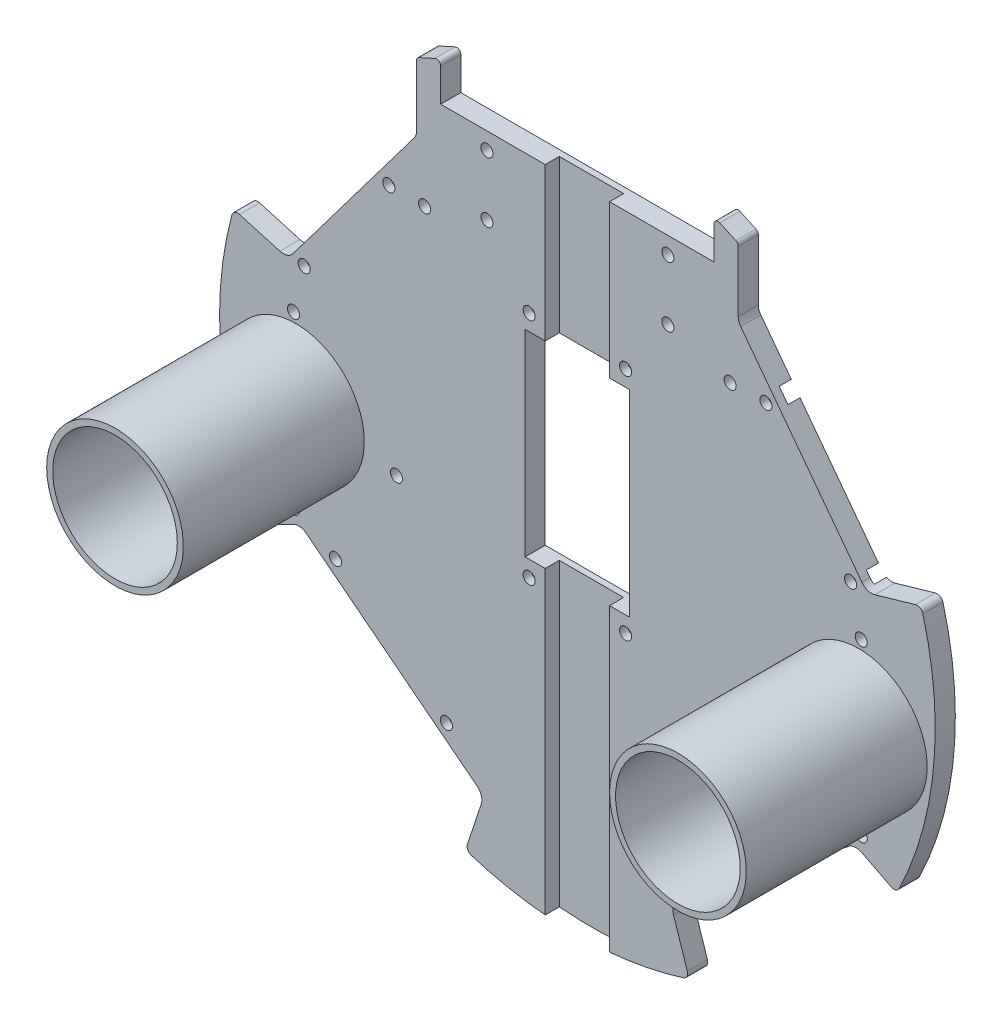
from build123d import *

# Parameters (mm, degrees)
EXTRUDE_2007_DEPTH      = 5
FILLET_3_R              = 1.5
FILLET_4_R              = 1.5
FILLET_5_R              = 1.5
FILLET_6_R              = 1.5
FILLET_8_R              = 1.5
FILLET_9_R              = 1.5
FILLET_10_R             = 1
SKETCH_3_R              = 17
EXTRUDE_3379_DEPTH      = 45
SKETCH_4_R              = 15.5
CUT_EXTRUDE_3486_DEPTH  = 45
SKETCH_5_R              = 1.5
CUT_EXTRUDE_4485_DEPTH  = 2
SKETCH_12_R             = 3.5
CUT_EXTRUDE_5429_DEPTH  = 3
CUT_EXTRUDE_START       = -3.5
CUT_EXTRUDE_6212_DEPTH  = 3.5
SKETCH_8_W              = 26
SKETCH_8_H              = 49
CUT_EXTRUDE_6714_DEPTH  = 5
SKETCH_9_R              = 1.5
CUT_EXTRUDE_7323_DEPTH  = 2
SKETCH_10_R             = 3.5
CUT_EXTRUDE_8111_DEPTH  = 3
SKETCH_11_R             = 1.5
CUT_EXTRUDE_8692_DEPTH  = 5
SKETCH_14_W             = 68
SKETCH_14_H             = 4
CUT_EXTRUDE_1_DEPTH     = 10
SKETCH_15_R             = 1.5
CUT_EXTRUDE_9738_DEPTH  = 134.667497919
SKETCH_16_R             = 1.5
CUT_EXTRUDE_10559_DEPTH = 10


with BuildPart() as part:
    # 草图1 → Extrude 2007 (new body)
    with BuildSketch(Plane.XY):
        with BuildLine():
            Line((40.60409347, 62.431357903), (55.904485703, 42.127051621))
            Line((55.904485703, 42.127051621), (70.756031924, 22.418384115))
            ThreePointArc((70.756031924, 22.418384115), (72.202279258, 21.378104776), (73.983419946, 21.341358278))
            Line((73.983419946, 21.341358278), (85.513303574, 24.667284243))
            ThreePointArc((85.513303574, 24.667284243), (88.605814226, -8.36717906), (79.384125876, -40.238794203))
            Line((79.384125876, -40.238794203), (70.659905832, -35.816599072))
            ThreePointArc((70.659905832, -35.816599072), (69.012874234, -35.506582977), (67.456557556, -36.128436223))
            Line((67.456557556, -36.128436223), (43.096303273, -55.160752752))
            Line((43.096303273, -55.160752752), (24.916466517, -69.364397902))
            ThreePointArc((24.916466517, -69.364397902), (23.892889166, -70.856722021), (23.91379502, -72.666226046))
            Line((23.91379502, -72.666226046), (27.821277866, -84.539792393))
            ThreePointArc((27.821277866, -84.539792393), (0, -89), (-27.821277866, -84.539792393))
            Line((-27.821277866, -84.539792393), (-23.91379502, -72.666226046))
            ThreePointArc((-23.91379502, -72.666226046), (-23.892889166, -70.856722021), (-24.916466517, -69.364397902))
            Line((-24.916466517, -69.364397902), (-43.096303273, -55.160752752))
            Line((-43.096303273, -55.160752752), (-67.456557556, -36.128436223))
            ThreePointArc((-67.456557556, -36.128436223), (-69.012874234, -35.506582977), (-70.659905832, -35.816599072))
            Line((-70.659905832, -35.816599072), (-79.384125876, -40.238794203))
            ThreePointArc((-79.384125876, -40.238794203), (-88.605814226, -8.36717906), (-85.513303574, 24.667284243))
            Line((-85.513303574, 24.667284243), (-73.983419946, 21.341358278))
            ThreePointArc((-73.983419946, 21.341358278), (-72.202279258, 21.378104776), (-70.756031924, 22.418384115))
            Line((-70.756031924, 22.418384115), (-55.904485703, 42.127051621))
            Line((-55.904485703, 42.127051621), (-40.60409347, 62.431357903))
            ThreePointArc((-40.60409347, 62.431357903), (-40.155029034, 63.284889003), (-40, 64.236802972))
            Line((-40, 64.236802972), (-40, 74))
            Line((-40, 74), (-40, 80.06403687))
            Line((-40, 80.06403687), (-34, 82.790397994))
            Line((-34, 82.790397994), (-34, 77))
            Line((-34, 77), (34, 77))
            Line((34, 77), (34, 82.790397994))
            Line((34, 82.790397994), (40, 80.06403687))
            Line((40, 80.06403687), (40, 74))
            Line((40, 74), (40, 64.236802972))
            ThreePointArc((40, 64.236802972), (40.155029034, 63.284889003), (40.60409347, 62.431357903))
        make_face()
    extrude(amount=EXTRUDE_2007_DEPTH)

    # 圆角3
    fillet_3_edges = [part.edges().sort_by_distance(p)[0] for p in [
        (79.384125876, -40.238794203, 2.5),
    ]]
    fillet(fillet_3_edges, radius=FILLET_3_R)

    # 圆角4
    fillet_4_edges = [part.edges().sort_by_distance(p)[0] for p in [
        (27.821277866, -84.539792393, 2.5),
    ]]
    fillet(fillet_4_edges, radius=FILLET_4_R)

    # 圆角5
    fillet_5_edges = [part.edges().sort_by_distance(p)[0] for p in [
        (-27.821277866, -84.539792393, 2.5),
    ]]
    fillet(fillet_5_edges, radius=FILLET_5_R)

    # 圆角6
    fillet_6_edges = [part.edges().sort_by_distance(p)[0] for p in [
        (-79.384125876, -40.238794203, 2.5),
    ]]
    fillet(fillet_6_edges, radius=FILLET_6_R)

    # 圆角8
    fillet_8_edges = [part.edges().sort_by_distance(p)[0] for p in [
        (85.513303574, 24.667284243, 2.5),
    ]]
    fillet(fillet_8_edges, radius=FILLET_8_R)

    # 圆角9
    fillet_9_edges = [part.edges().sort_by_distance(p)[0] for p in [
        (-85.513303574, 24.667284243, 2.5),
    ]]
    fillet(fillet_9_edges, radius=FILLET_9_R)

    # 圆角10
    fillet_10_edges = [part.edges().sort_by_distance(p)[0] for p in [
        (-40, 80.06403687, 2.5),
        (-34, 82.790397994, 2.5),
        (34, 82.790397994, 2.5),
        (40, 80.06403687, 2.5),
    ]]
    fillet(fillet_10_edges, radius=FILLET_10_R)

    # 草图3 → Extrude 3379 (add)
    with BuildSketch(Plane.XY.offset(5)):
        with Locations(Location((70, -9.25, 0), (0, 0, 180))):
            Circle(SKETCH_3_R)
    extrude_3379 = extrude(amount=EXTRUDE_3379_DEPTH)

    # 草图4 → Cut-Extrude 3486 (cut)
    with BuildSketch(Plane.XY.offset(50)):
        with Locations((70, -9.25)):
            Circle(SKETCH_4_R)
    cut_extrude_3486 = extrude(amount=-CUT_EXTRUDE_3486_DEPTH, mode=Mode.SUBTRACT)

    # 镜向1: Extrude 3379 across plane
    add(extrude_3379.mirror(Plane(origin=(0, 0, 0), x_dir=(0, 0, 1), z_dir=(1, 0, 0))))

    # 镜向2: Cut-Extrude 3486 across plane
    add(cut_extrude_3486.mirror(Plane(origin=(0, 0, 0), x_dir=(0, 0, 1), z_dir=(1, 0, 0))), mode=Mode.SUBTRACT)

    # 草图5 → Cut-Extrude 4485 (cut)
    with BuildSketch(Plane.XY.offset(5)):
        with Locations((46.888613918, 49.106597162)):
            Circle(SKETCH_5_R)
        with Locations((67.952139729, 21.15435431)):
            Circle(SKETCH_5_R)
        with Locations(Location((-67.952139729, 21.15435431, 0), (0, 0, 180))):
            Circle(SKETCH_5_R)
        with Locations(Location((-46.888613918, 49.106597162, 0), (0, 0, 180))):
            Circle(SKETCH_5_R)
        with Locations((60.161576933, -38.020845084)):
            Circle(SKETCH_5_R)
        with Locations((32.581200557, -59.56899672)):
            Circle(SKETCH_5_R)
        with Locations(Location((-60.161576933, -38.020845084, 0), (0, 0, 180))):
            Circle(SKETCH_5_R)
        with Locations(Location((-32.581200557, -59.56899672, 0), (0, 0, 180))):
            Circle(SKETCH_5_R)
    extrude(amount=-CUT_EXTRUDE_4485_DEPTH, mode=Mode.SUBTRACT)

    # 草图12 → Cut-Extrude 5429 (cut)
    with BuildSketch(Plane(origin=(0, 0, 0), x_dir=(-1, 0, 0), z_dir=(0, 0, -1))):
        with Locations((46.888613918, 49.106597162)):
            Circle(SKETCH_12_R)
        with Locations((68.553954752, 20.3557188)):
            Circle(SKETCH_12_R)
        with Locations((-68.553954752, 20.3557188)):
            Circle(SKETCH_12_R)
        with Locations((-46.888613918, 49.106597162)):
            Circle(SKETCH_12_R)
        with Locations((32.581200557, -59.56899672)):
            Circle(SKETCH_12_R)
        with Locations((60.161576933, -38.020845084)):
            Circle(SKETCH_12_R)
        with Locations((13.527038551, -115.928745256)):
            Circle(SKETCH_12_R)
        with Locations((-60.161576933, -38.020845084)):
            Circle(SKETCH_12_R)
        with Locations((-32.581200557, -59.56899672)):
            Circle(SKETCH_12_R)
    extrude(amount=-CUT_EXTRUDE_5429_DEPTH, mode=Mode.SUBTRACT)

    # 草图7 → Cut-Extrude 6212 (cut)
    with BuildSketch(Plane.XY.offset(5).offset(CUT_EXTRUDE_START)):
        with BuildLine():
            Line((-8, 77), (-8, -88.639720216))
            ThreePointArc((-8, -88.639720216), (0, -89), (8, -88.639720216))
            Line((8, -88.639720216), (8, 77))
            Line((8, 77), (-8, 77))
        make_face()
    extrude(amount=CUT_EXTRUDE_6212_DEPTH, mode=Mode.SUBTRACT)

    # 草图8 → Cut-Extrude 6714 (cut)
    with BuildSketch(Plane.XY.offset(5)):
        with Locations((0, 10.5)):
            Rectangle(SKETCH_8_W, SKETCH_8_H)
    extrude(amount=-CUT_EXTRUDE_6714_DEPTH, mode=Mode.SUBTRACT)

    # 草图9 → Cut-Extrude 7323 (cut)
    with BuildSketch(Plane.XY.offset(5)):
        with Locations((12, 39)):
            Circle(SKETCH_9_R)
        with Locations(Location((-12, 39, 0), (0, 0, 180))):
            Circle(SKETCH_9_R)
        with Locations((-12, -18)):
            Circle(SKETCH_9_R)
        with Locations(Location((12, -18, 0), (0, 0, 180))):
            Circle(SKETCH_9_R)
    extrude(amount=-CUT_EXTRUDE_7323_DEPTH, mode=Mode.SUBTRACT)

    # 草图10 → Cut-Extrude 8111 (cut)
    with BuildSketch(Plane(origin=(0, 0, 0), x_dir=(-1, 0, 0), z_dir=(0, 0, -1))):
        with Locations((12, 39)):
            Circle(SKETCH_10_R)
        with Locations(Location((-12, 39, 0), (0, 0, 180))):
            Circle(SKETCH_10_R)
        with Locations(Location((12, -18, 0), (0, 0, 180))):
            Circle(SKETCH_10_R)
        with Locations((-12, -18)):
            Circle(SKETCH_10_R)
    extrude(amount=-CUT_EXTRUDE_8111_DEPTH, mode=Mode.SUBTRACT)

    # 草图11 → Cut-Extrude 8692 (cut)
    with BuildSketch(Plane.XY.offset(5)):
        with Locations((22.5, 68.8)):
            Circle(SKETCH_11_R)
        with Locations((22.5, 53.8)):
            Circle(SKETCH_11_R)
        with Locations(Location((-22.5, 53.8, 0), (0, 0, 180))):
            Circle(SKETCH_11_R)
        with Locations(Location((-22.5, 68.8, 0), (0, 0, 180))):
            Circle(SKETCH_11_R)
    extrude(amount=-CUT_EXTRUDE_8692_DEPTH, mode=Mode.SUBTRACT)

    # 草图14 → 切除-拉伸1 (cut)
    with BuildSketch(Plane(origin=(0, 0, 0), x_dir=(-1, 0, 0), z_dir=(0, 0, -1))):
        with Locations((0, 75)):
            Rectangle(SKETCH_14_W, SKETCH_14_H)
    extrude(amount=-CUT_EXTRUDE_1_DEPTH, mode=Mode.SUBTRACT)

    # 草图15 → Cut-Extrude 9738 (cut, through all)
    with BuildSketch(Plane.XY.offset(5)):
        with Locations(Location((-45, -12.5, 0), (0, 0, 180))):
            Circle(SKETCH_15_R)
        with Locations(Location((-38, 49, 0), (0, 0, 180))):
            Circle(SKETCH_15_R)
        with Locations((38, 49)):
            Circle(SKETCH_15_R)
        with Locations((45, -12.5)):
            Circle(SKETCH_15_R)
    extrude(amount=-CUT_EXTRUDE_9738_DEPTH, mode=Mode.SUBTRACT)

    # 草图16 → Cut-Extrude 10559 (cut)
    with BuildSketch(Plane.XY.offset(5)):
        with Locations((-70.6, -32.2)):
            Circle(SKETCH_16_R)
        with Locations((-70.6, 10)):
            Circle(SKETCH_16_R)
        with Locations((70.6, 10)):
            Circle(SKETCH_16_R)
        with Locations((70.6, -32.2)):
            Circle(SKETCH_16_R)
    extrude(amount=-CUT_EXTRUDE_10559_DEPTH, mode=Mode.SUBTRACT)


solid = part.part
